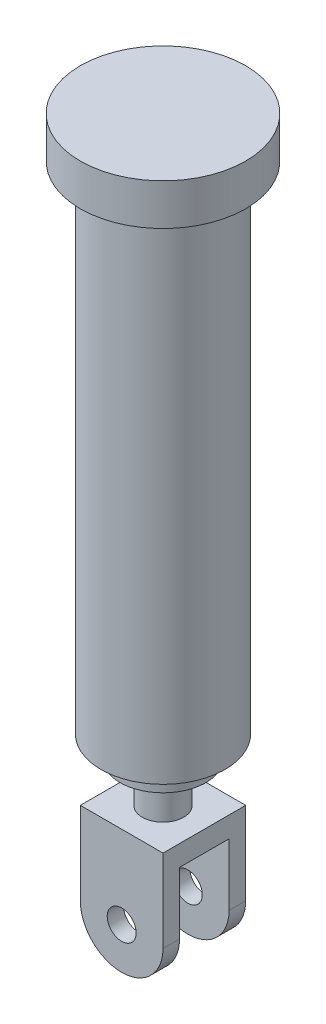
from build123d import *

# Parameters (mm, degrees)
SKETCH3_R           = 20
BOSS_EXTRUDE1_DEPTH = 10
SKETCH4_R           = 15
BOSS_EXTRUDE2_DEPTH = 120
SKETCH5_R           = 10.435871031
BOSS_EXTRUDE3_DEPTH = 5
SKETCH6_R           = 5
BOSS_EXTRUDE4_DEPTH = 10
SKETCH7_W           = 20
SKETCH7_H           = 20
BOSS_EXTRUDE5_DEPTH = 5
SKETCH8_R           = 3.5
BOSS_EXTRUDE6_DEPTH = 20
SKETCH9_W           = 12
SKETCH9_H           = 25
CUT_EXTRUDE1_DEPTH  = 27


with BuildPart() as part:
    # Sketch3 → Boss-Extrude1 (new body)
    with BuildSketch(Plane(origin=(0, 0, 0), x_dir=(1, 0, 0), z_dir=(0, 1, 0))):
        with Locations(Location((0, 0, 0), (0, 0, 270))):
            Circle(SKETCH3_R)
    extrude(amount=-BOSS_EXTRUDE1_DEPTH)

    # Sketch4 → Boss-Extrude2 (add)
    with BuildSketch(Plane.XZ.offset(10)):
        with Locations(Location((0, 0, 0), (0, 0, 270))):
            Circle(SKETCH4_R)
    extrude(amount=BOSS_EXTRUDE2_DEPTH)

    # Sketch5 → Boss-Extrude3 (add)
    with BuildSketch(Plane.XZ.offset(130)):
        with Locations(Location((0, 0, 0), (0, 0, 270))):
            Circle(SKETCH5_R)
    extrude(amount=BOSS_EXTRUDE3_DEPTH)

    # Sketch6 → Boss-Extrude4 (add)
    with BuildSketch(Plane(origin=(0, -135, 0), x_dir=(-1, 0, 0), z_dir=(0, -1, 0))):
        with Locations(Location((0, 0, 0), (0, 0, 90))):
            Circle(SKETCH6_R)
    extrude(amount=BOSS_EXTRUDE4_DEPTH)

    # Sketch7 → Boss-Extrude5 (add)
    with BuildSketch(Plane.XZ.offset(145)):
        Rectangle(SKETCH7_W, SKETCH7_H)
    extrude(amount=BOSS_EXTRUDE5_DEPTH)

    # Sketch8 → Boss-Extrude6 (add)
    with BuildSketch(Plane(origin=(0, 0, -10), x_dir=(-1, 0, 0), z_dir=(0, 0, -1))):
        with BuildLine():
            Line((-10, -150), (-10, -165))
            ThreePointArc((-10, -165), (0, -175), (10, -165))
            Line((10, -165), (10, -150))
            Line((10, -150), (-10, -150))
        make_face()
        with Locations((0, -165)):
            Circle(SKETCH8_R, mode=Mode.SUBTRACT)
    extrude(amount=-BOSS_EXTRUDE6_DEPTH)

    # Sketch9 → Cut-Extrude1 (cut, symmetric)
    with BuildSketch(Plane.ZY.offset(10)):
        with Locations((0, -162.5)):
            Rectangle(SKETCH9_W, SKETCH9_H)
    extrude(amount=CUT_EXTRUDE1_DEPTH, both=True, mode=Mode.SUBTRACT)


solid = part.part
